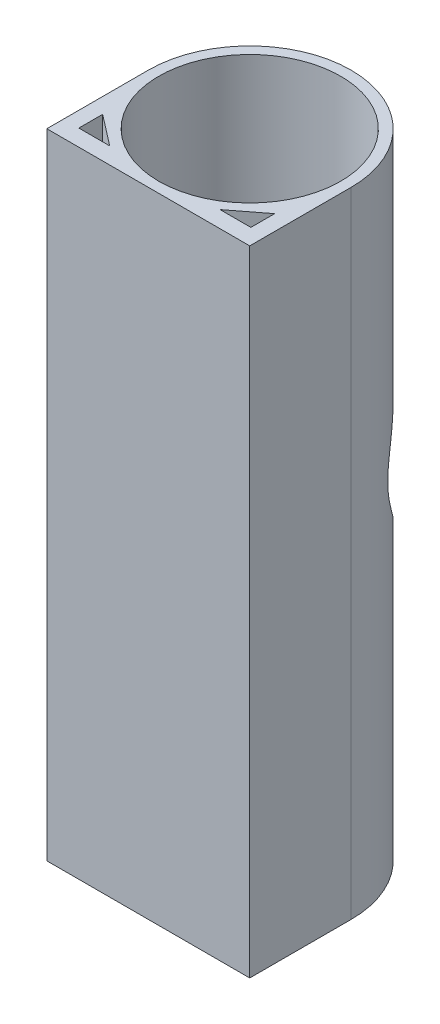
from build123d import *

# Parameters (mm, degrees)
SKETCH1_R           = 14.35
BOSS_EXTRUDE1_DEPTH = 100
CUT_EXTRUDE3_START  = -35
SKETCH2_R           = 13.97
CUT_EXTRUDE3_DEPTH  = 15


with BuildPart() as part:
    # Sketch1 → Boss-Extrude1 (new body)
    with BuildSketch(Plane(origin=(0, 0, 0), x_dir=(1, 0, 0), z_dir=(0, 1, 0))):
        with BuildLine():
            Line((16, -16), (-16, -16))
            Line((-16, -16), (-16, 0))
            ThreePointArc((-16, 0), (0, 16), (16, 0))
            Line((16, 0), (16, -16))
        make_face()
        with Locations(Location((0, 0, 0), (0, 0, 270))):
            Circle(SKETCH1_R, mode=Mode.SUBTRACT)
        Polygon((-13.566960835, -13.387527792), (-8.700031969, -13.387527792), (-13.566960835, -9.631173298), align=None, mode=Mode.SUBTRACT)
        Polygon((13.566960835, -13.387527792), (8.700031969, -13.387527792), (13.566960835, -9.631173298), align=None, mode=Mode.SUBTRACT)
    extrude(amount=BOSS_EXTRUDE1_DEPTH)

    # Sketch2 → Cut-Extrude3 (cut, symmetric)
    with BuildSketch(Plane.XY.offset(16).offset(CUT_EXTRUDE3_START)):
        with Locations((0, 54.866576619)):
            Circle(SKETCH2_R)
    extrude(amount=CUT_EXTRUDE3_DEPTH, both=True, mode=Mode.SUBTRACT)


solid = part.part
